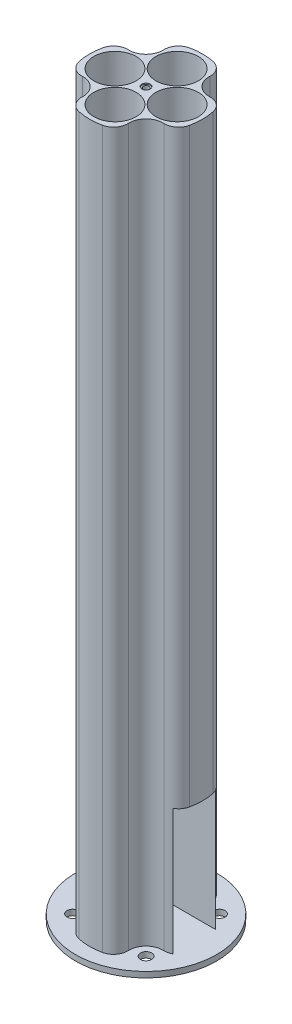
from build123d import *
from build123d.topology import SkipClean

# Parameters (mm, degrees)
SKETCH1_R           = 100
BOSS_EXTRUDE2_DEPTH = 1120
SKETCH4_R           = 37.5
CUT_EXTRUDE1_DEPTH  = 1100
SKETCH6_R           = 30.030042901
CUT_EXTRUDE2_DEPTH  = 1129.893263334
SKETCH7_R           = 5
CUT_EXTRUDE3_DEPTH  = 1200
FILLET1_R           = 25
SKETCH8_W           = 276.180333513
SKETCH8_H           = 316.248560879
CUT_EXTRUDE4_DEPTH  = 65
SKETCH9_R           = 7.5
CUT_EXTRUDE5_DEPTH  = 2
BOSS_EXTRUDE3_START = 223.21458
BOSS_EXTRUDE3_DEPTH = 223.21458
SKETCH11_R          = 125
BOSS_EXTRUDE4_DEPTH = 10
SKETCH12_W          = 75
SKETCH12_H          = 223.21458
CUT_EXTRUDE6_DEPTH  = 123
CUT_EXTRUDE7_REACH  = 1292.381
SKETCH13_R          = 10


with BuildPart() as part:
    # Sketch1 → Boss-Extrude2 (new body)
    with BuildSketch(Plane(origin=(0, 0, 0), x_dir=(1, 0, 0), z_dir=(0, 1, 0))):
        with Locations(Location((0, 0, 0), (0, 0, 270))):
            Circle(SKETCH1_R)
    extrude(amount=BOSS_EXTRUDE2_DEPTH)

    # Sketch4 → Cut-Extrude1 (cut)
    with BuildSketch(Plane(origin=(0, 1120, 0), x_dir=(1, 0, 0), z_dir=(0, 1, 0))):
        with Locations(Location((55, 0, 0), (0, 0, 270))):
            Circle(SKETCH4_R)
        with Locations(Location((0, 55, 0), (0, 0, 270))):
            Circle(SKETCH4_R)
        with Locations(Location((-55, 0, 0), (0, 0, 270))):
            Circle(SKETCH4_R)
        with Locations(Location((0, -55, 0), (0, 0, 270))):
            Circle(SKETCH4_R)
    extrude(amount=-CUT_EXTRUDE1_DEPTH, mode=Mode.SUBTRACT)

    # Sketch6 → Cut-Extrude2 (cut, through all)
    with BuildSketch(Plane(origin=(0, 1120, 0), x_dir=(1, 0, 0), z_dir=(0, 1, 0))):
        with Locations((-70.710678119, 70.710678119)):
            Circle(SKETCH6_R)
        with Locations((70.710678119, 70.710678119)):
            Circle(SKETCH6_R)
        with Locations((70.710678119, -70.710678119)):
            Circle(SKETCH6_R)
        with Locations((-70.710678119, -70.710678119)):
            Circle(SKETCH6_R)
    extrude(amount=-CUT_EXTRUDE2_DEPTH, mode=Mode.SUBTRACT)

    # Sketch7 → Cut-Extrude3 (cut)
    with BuildSketch(Plane(origin=(0, 1120, 0), x_dir=(1, 0, 0), z_dir=(0, 1, 0))):
        with Locations(Location((0, 0, 0), (0, 0, 270))):
            Circle(SKETCH7_R)
    extrude(amount=-CUT_EXTRUDE3_DEPTH, mode=Mode.SUBTRACT)

    # Fillet1
    fillet1_edges = [part.edges().sort_by_distance(p)[0] for p in [
        (-46.528605162, 560, 88.51603754),
        (-88.51603754, 560, 46.528605162),
        (88.51603754, 560, 46.528605162),
        (46.528605162, 560, 88.51603754),
        (46.528605162, 560, -88.51603754),
        (88.51603754, 560, -46.528605162),
        (-88.51603754, 560, -46.528605162),
        (-46.528605162, 560, -88.51603754),
    ]]
    fillet(fillet1_edges, radius=FILLET1_R)

    # Sketch8 → Cut-Extrude4 (cut)
    with BuildSketch(Plane(origin=(0, 1120, 0), x_dir=(1, 0, 0), z_dir=(0, 1, 0))):
        with Locations((9.785456368, -2.918303702)):
            Rectangle(SKETCH8_W, SKETCH8_H)
    extrude(amount=-CUT_EXTRUDE4_DEPTH, mode=Mode.SUBTRACT)

    # Sketch9 → Cut-Extrude5 (cut)
    with BuildSketch(Plane(origin=(0, 1055, 0), x_dir=(1, 0, 0), z_dir=(0, 1, 0))):
        with Locations(Location((0, 0, 0), (0, 0, 270))):
            Circle(SKETCH9_R)
    extrude(amount=-CUT_EXTRUDE5_DEPTH, mode=Mode.SUBTRACT)

    # Sketch10 → Boss-Extrude3 (add)
    with SkipClean():  # the faces are left unmerged after this step: merging them gives an invalid solid
        with BuildSketch(Plane.XZ.offset(BOSS_EXTRUDE3_START)):
            with BuildLine():
                ThreePointArc((20.990620884, 97.772152656), (0, 100), (-20.990620884, 97.772152656))
                ThreePointArc((-20.990620884, 97.772152656), (-35.556079582, 88.575114519), (-40.71464911, 72.139565913))
                ThreePointArc((-40.71464911, 72.139565913), (-49.476231144, 49.476231144), (-72.139565913, 40.71464911))
                ThreePointArc((-72.139565913, 40.71464911), (-88.575114519, 35.556079582), (-97.772152656, 20.990620884))
                ThreePointArc((-97.772152656, 20.990620884), (-100, 0), (-97.772152656, -20.990620884))
                ThreePointArc((-97.772152656, -20.990620884), (-88.575114519, -35.556079582), (-72.139565913, -40.71464911))
                ThreePointArc((-72.139565913, -40.71464911), (-49.476231144, -49.476231144), (-40.71464911, -72.139565913))
                ThreePointArc((-40.71464911, -72.139565913), (-35.556079582, -88.575114519), (-20.990620884, -97.772152656))
                ThreePointArc((-20.990620884, -97.772152656), (0, -100), (20.990620884, -97.772152656))
                ThreePointArc((20.990620884, -97.772152656), (35.556079582, -88.575114519), (40.71464911, -72.139565913))
                ThreePointArc((40.71464911, -72.139565913), (49.476231144, -49.476231144), (72.139565913, -40.71464911))
                ThreePointArc((72.139565913, -40.71464911), (88.575114519, -35.556079582), (97.772152656, -20.990620884))
                ThreePointArc((97.772152656, -20.990620884), (100, 0), (97.772152656, 20.990620884))
                ThreePointArc((97.772152656, 20.990620884), (88.575114519, 35.556079582), (72.139565913, 40.71464911))
                ThreePointArc((72.139565913, 40.71464911), (49.476231144, 49.476231144), (40.71464911, 72.139565913))
                ThreePointArc((40.71464911, 72.139565913), (35.556079582, 88.575114519), (20.990620884, 97.772152656))
            make_face()
        extrude(amount=-BOSS_EXTRUDE3_DEPTH)

    # Sketch11 → Boss-Extrude4 (add)
    with SkipClean():  # the faces are left unmerged after this step: merging them gives an invalid solid
        with BuildSketch(Plane.XZ.offset(223.21458)):
            with Locations(Location((0, 0, 0), (0, 0, 270))):
                Circle(SKETCH11_R)
        extrude(amount=-BOSS_EXTRUDE4_DEPTH)

    # Sketch12 → Cut-Extrude6 (cut, symmetric)
    with SkipClean():  # the faces are left unmerged after this step: merging them gives an invalid solid
        with BuildSketch(Plane(origin=(0, 0, 0), x_dir=(0, 0, -1), z_dir=(1, 0, 0))):
            with Locations((0, -101.60729)):
                Rectangle(SKETCH12_W, SKETCH12_H)
        extrude(amount=CUT_EXTRUDE6_DEPTH, both=True, mode=Mode.SUBTRACT)

    # Sketch13 → Cut-Extrude7 (cut, up to next)
    with BuildSketch(Plane.XZ.offset(223.21458), mode=Mode.PRIVATE) as cut_extrude7_sk1:
        with Locations(Location((65, 65, 0), (0, 0, 270))):
            Circle(SKETCH13_R)
    cut_extrude7_tool1 = extrude(cut_extrude7_sk1.sketch, amount=-CUT_EXTRUDE7_REACH, mode=Mode.PRIVATE) & part.part
    # Sketch13 → Cut-Extrude7 (cut, up to next)
    with BuildSketch(Plane.XZ.offset(223.21458), mode=Mode.PRIVATE) as cut_extrude7_sk2:
        with Locations(Location((65, -65, 0), (0, 0, 270))):
            Circle(SKETCH13_R)
    cut_extrude7_tool2 = extrude(cut_extrude7_sk2.sketch, amount=-CUT_EXTRUDE7_REACH, mode=Mode.PRIVATE) & part.part
    # Sketch13 → Cut-Extrude7 (cut, up to next)
    with BuildSketch(Plane.XZ.offset(223.21458), mode=Mode.PRIVATE) as cut_extrude7_sk3:
        with Locations(Location((-65, -65, 0), (0, 0, 270))):
            Circle(SKETCH13_R)
    cut_extrude7_tool3 = extrude(cut_extrude7_sk3.sketch, amount=-CUT_EXTRUDE7_REACH, mode=Mode.PRIVATE) & part.part
    # Sketch13 → Cut-Extrude7 (cut, up to next)
    with BuildSketch(Plane.XZ.offset(223.21458), mode=Mode.PRIVATE) as cut_extrude7_sk4:
        with Locations(Location((-65, 65, 0), (0, 0, 270))):
            Circle(SKETCH13_R)
    cut_extrude7_tool4 = extrude(cut_extrude7_sk4.sketch, amount=-CUT_EXTRUDE7_REACH, mode=Mode.PRIVATE) & part.part
    add(cut_extrude7_tool1.solids().sort_by_distance((65, -223.21458, 65))[0], mode=Mode.SUBTRACT)
    add(cut_extrude7_tool2.solids().sort_by_distance((65, -223.21458, -65))[0], mode=Mode.SUBTRACT)
    add(cut_extrude7_tool3.solids().sort_by_distance((-65, -223.21458, -65))[0], mode=Mode.SUBTRACT)
    add(cut_extrude7_tool4.solids().sort_by_distance((-65, -223.21458, 65))[0], mode=Mode.SUBTRACT)


solid = part.part
